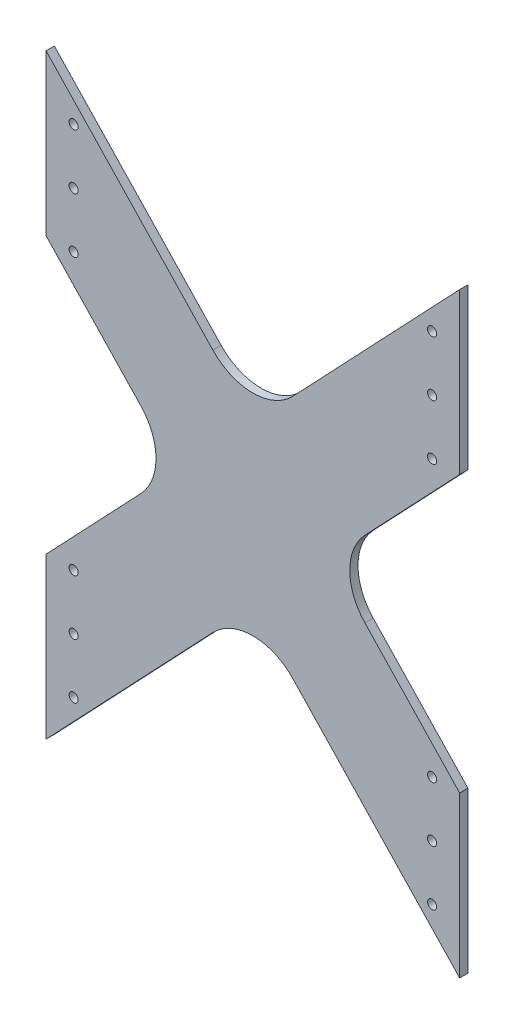
from build123d import *

# Parameters (mm, degrees)
SKETCH_1_R      = 1.65
EXTRUDE_1_DEPTH = 3
FILLET_1_R      = 20


with BuildPart() as part:
    # 草图1 → 凸台-拉伸1 (new body)
    with BuildSketch(Plane.XY):
        Polygon((-81.159641577, 128.097043492), (-81.160013188, 69.97789137), (-33.727366855, 19.978035289), (-81.160652583, -30.022108629), (-81.161024198, -88.141807947), (-6.159655428, -9.081730725), (68.841408465, -88.142097171), (68.841260976, -30.022397853), (21.408168061, 19.97792898), (68.841007207, 69.977602148), (68.840859718, 128.096754271), (-6.159543366, 49.037694994), align=None)
        with Locations((-71.160908341, -70.022108629)):
            Circle(SKETCH_1_R, mode=Mode.SUBTRACT)
        with Locations((-71.160780462, -50.022108629)):
            Circle(SKETCH_1_R, mode=Mode.SUBTRACT)
        with Locations((-71.160652583, -30.022108629)):
            Circle(SKETCH_1_R, mode=Mode.SUBTRACT)
        with Locations((58.841362483, -70.02235929)):
            Circle(SKETCH_1_R, mode=Mode.SUBTRACT)
        with Locations((58.841311729, -50.02235929)):
            Circle(SKETCH_1_R, mode=Mode.SUBTRACT)
        with Locations((58.841260976, -30.02235929)):
            Circle(SKETCH_1_R, mode=Mode.SUBTRACT)
        with Locations((-71.160013188, 69.97787102)):
            Circle(SKETCH_1_R, mode=Mode.SUBTRACT)
        with Locations((-71.159885309, 89.977871019)):
            Circle(SKETCH_1_R, mode=Mode.SUBTRACT)
        with Locations((-71.15975743, 109.977871019)):
            Circle(SKETCH_1_R, mode=Mode.SUBTRACT)
        with Locations((58.841007207, 69.977620361)):
            Circle(SKETCH_1_R, mode=Mode.SUBTRACT)
        with Locations((58.840956453, 89.977620361)):
            Circle(SKETCH_1_R, mode=Mode.SUBTRACT)
        with Locations((58.840905699, 109.977620361)):
            Circle(SKETCH_1_R, mode=Mode.SUBTRACT)
    extrude(amount=EXTRUDE_1_DEPTH)

    # 圆角1
    fillet_1_edges = [part.edges().sort_by_distance(p)[0] for p in [
        (21.408168061, 19.97792898, 1.5),
        (-6.159655428, -9.081730725, 1.5),
        (-33.727366855, 19.978035289, 1.5),
        (-6.159543366, 49.037694994, 1.5),
    ]]
    fillet(fillet_1_edges, radius=FILLET_1_R)


solid = part.part
